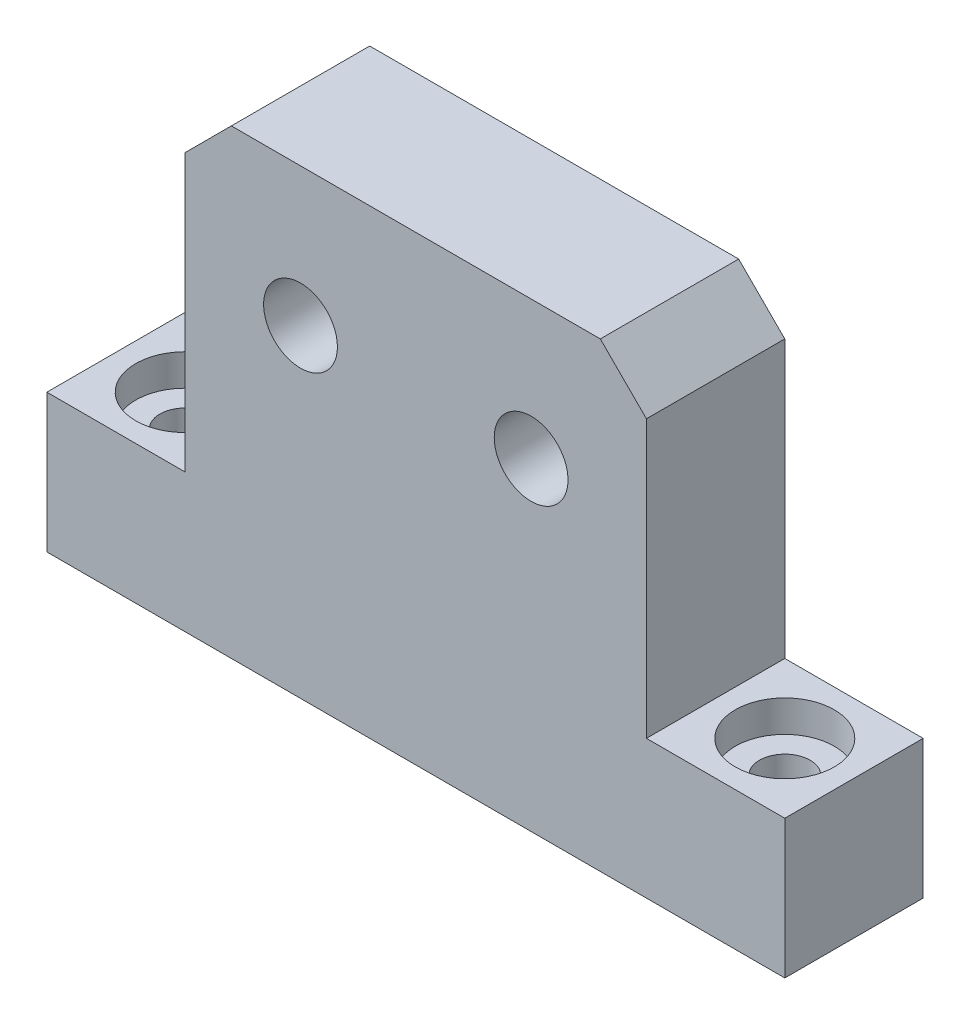
from build123d import *

# Parameters (mm, degrees)
SKETCH2_R                        = 8
CORPO_FUROS_20MM_DEPTH           = 30
CHANFROS_10X45_SIZE              = 10
REBAIXO_PARAFUSO_M10_D           = 11
REBAIXO_PARAFUSO_M10_CBORE_D     = 21.48
REBAIXO_PARAFUSO_M10_CBORE_DEPTH = 6.85


with BuildPart() as part:
    # Sketch2 → Corpo - Furos 20mm (new body)
    with BuildSketch(Plane.XY):
        Polygon((80, 0), (-80, 0), (-80, 30), (-50, 30), (-50, 100), (0, 100), (50, 100), (50, 30), (80, 30), align=None)
        with Locations((-25, 70)):
            Circle(SKETCH2_R, mode=Mode.SUBTRACT)
        with Locations(Location((25, 70, 0), (0, 0, 180))):
            Circle(SKETCH2_R, mode=Mode.SUBTRACT)
    extrude(amount=CORPO_FUROS_20MM_DEPTH)

    # Chanfros 10x45°
    chanfros_10x45_edges = [part.edges().sort_by_distance(p)[0] for p in [
        (50, 100, 15),
        (-50, 100, 15),
    ]]
    chamfer(chanfros_10x45_edges, length=CHANFROS_10X45_SIZE)

    # Rebaixo Parafuso M10 (through all)
    with Locations(Plane(origin=(0, 30, 0), x_dir=(1, 0, 0), z_dir=(0, 1, 0))):
        with Locations((-65, -15), (65, -15)):
            CounterBoreHole(REBAIXO_PARAFUSO_M10_D / 2, REBAIXO_PARAFUSO_M10_CBORE_D / 2, REBAIXO_PARAFUSO_M10_CBORE_DEPTH)


solid = part.part
